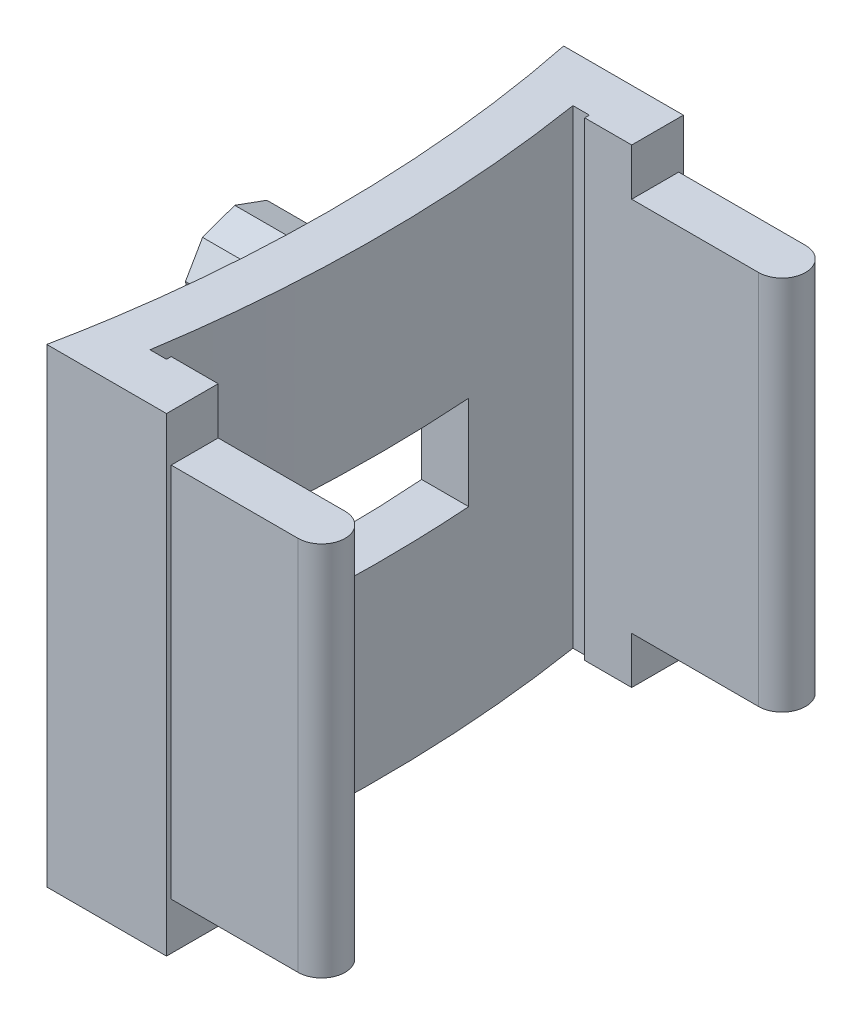
from build123d import *

# Parameters (mm, degrees)
BOSS_EXTRUDE1_DEPTH      = 50
SHELL1_T                 = -5
BOSS_EXTRUDE2_DEPTH      = 7.5
BOSS_EXTRUDE2_DEPTH_BACK = 5
SKETCH4_W                = 20
SKETCH4_H                = 10
CUT_EXTRUDE1_DEPTH       = 10
FILLET1_RADIUS           = 2.5
FILLET1_LENGTH           = 50
FILLET2_RADIUS           = 2.5
FILLET2_LENGTH           = 50
SKETCH7_W                = 16
SKETCH7_H                = 5
CUT_EXTRUDE3_DEPTH       = 10


with BuildPart() as part:
    # Sketch2 → Boss-Extrude1 (new body)
    with BuildSketch(Plane(origin=(0, 0, 0), x_dir=(1, 0, 0), z_dir=(0, 1, 0))):
        with BuildLine():
            Line((46.545206992, 27.5), (49.2865347, 27.5))
            Line((49.2865347, 27.5), (59.2865347, 27.5))
            Line((59.2865347, 27.5), (59.2865347, 27))
            Line((59.2865347, 27), (75.2865347, 27))
            Line((75.2865347, 27), (75.2865347, -27))
            Line((75.2865347, -27), (59.2865347, -27))
            Line((59.2865347, -27), (59.2865347, -27.5))
            Line((59.2865347, -27.5), (49.2865347, -27.5))
            Line((49.2865347, -27.5), (46.545206992, -27.5))
            add(Edge.make_bspline(
                [(46.545206992, -27.5), (52.189315716, 0), (46.545206992, 27.5)],
                knots=[4.377296144, 4.377296144, 4.377296144, 5.047481816, 5.047481816, 5.047481816], degree=2, weights=[1, 0.944379784, 1]))
        make_face()
    extrude(amount=BOSS_EXTRUDE1_DEPTH)

    # Shell1
    shell1_openings = [part.faces().sort_by_distance(p)[0] for p in [
        (61.762813671, 50, 0),
        (61.762813671, 0, 0),
        (75.2865347, 25, 0),
    ]]
    offset(amount=SHELL1_T, openings=shell1_openings, kind=Kind.INTERSECTION)

    # Sketch3 → Boss-Extrude2 (add, two sides: drawn at the far end of the back side and taken through both)
    with BuildSketch(Plane.ZY.offset(-46.545206992).offset(-BOSS_EXTRUDE2_DEPTH_BACK)):
        Polygon((-5.240052605, 40.923962655), (-4.608024926, 37.339555569), (-1.819851171, 35), (1.819851171, 35), (4.608024926, 37.339555569), (5.240052605, 40.923962655), (3.420201433, 44.076037345), (0, 45.320888862), (-3.420201433, 44.076037345), align=None)
        Polygon((0, 4.679111138), (3.420201433, 5.923962655), (5.240052605, 9.076037345), (4.608024926, 12.660444431), (1.819851171, 15), (-1.819851171, 15), (-4.608024926, 12.660444431), (-5.240052605, 9.076037345), (-3.420201433, 5.923962655), align=None)
    extrude(amount=BOSS_EXTRUDE2_DEPTH + BOSS_EXTRUDE2_DEPTH_BACK)

    # Sketch4 → Cut-Extrude1 (cut)
    with BuildSketch(Plane.ZY.offset(-46.545206992)):
        with Locations((0, 25)):
            Rectangle(SKETCH4_W, SKETCH4_H)
    extrude(amount=-CUT_EXTRUDE1_DEPTH, mode=Mode.SUBTRACT)

    # Fillet1: full round fillet: the end face becomes a half cylinder, R = half its width
    fillet1_face = Plane((75.2865347, 25, -24.5), x_dir=(0, 1, 0), z_dir=(1, 0, 0))  # on the end face: x along it, z out of the body
    fillet1_slab = fillet1_face.offset(-FILLET1_RADIUS / 2) * Box(FILLET1_LENGTH, 2 * FILLET1_RADIUS, FILLET1_RADIUS, mode=Mode.PRIVATE)  # the body's end, R deep
    fillet1_round = Plane((72.7865347, 25, -24.5), x_dir=(1, 0, 0), z_dir=(0, 1, 0)) * Cylinder(FILLET1_RADIUS, FILLET1_LENGTH, mode=Mode.PRIVATE)  # its axis R under the face
    add(fillet1_slab - fillet1_round, mode=Mode.SUBTRACT)

    # Fillet2: full round fillet: the end face becomes a half cylinder, R = half its width
    fillet2_face = Plane((75.2865347, 25, 24.5), x_dir=(0, -1, 0), z_dir=(1, 0, 0))  # on the end face: x along it, z out of the body
    fillet2_slab = fillet2_face.offset(-FILLET2_RADIUS / 2) * Box(FILLET2_LENGTH, 2 * FILLET2_RADIUS, FILLET2_RADIUS, mode=Mode.PRIVATE)  # the body's end, R deep
    fillet2_round = Plane((72.7865347, 25, 24.5), x_dir=(1, 0, 0), z_dir=(0, -1, 0)) * Cylinder(FILLET2_RADIUS, FILLET2_LENGTH, mode=Mode.PRIVATE)  # its axis R under the face
    add(fillet2_slab - fillet2_round, mode=Mode.SUBTRACT)

    # Sketch7 → Cut-Extrude3 (cut)
    with BuildSketch(Plane.XY.offset(27)):
        with Locations((67.2865347, 47.5)):
            Rectangle(SKETCH7_W, SKETCH7_H)
        with Locations((67.2865347, 2.5)):
            Rectangle(SKETCH7_W, SKETCH7_H)
    cut_extrude3 = extrude(amount=-CUT_EXTRUDE3_DEPTH, mode=Mode.SUBTRACT)

    # Mirror2: Cut-Extrude3 across plane
    add(cut_extrude3.mirror(Plane.XY), mode=Mode.SUBTRACT)


solid = part.part
